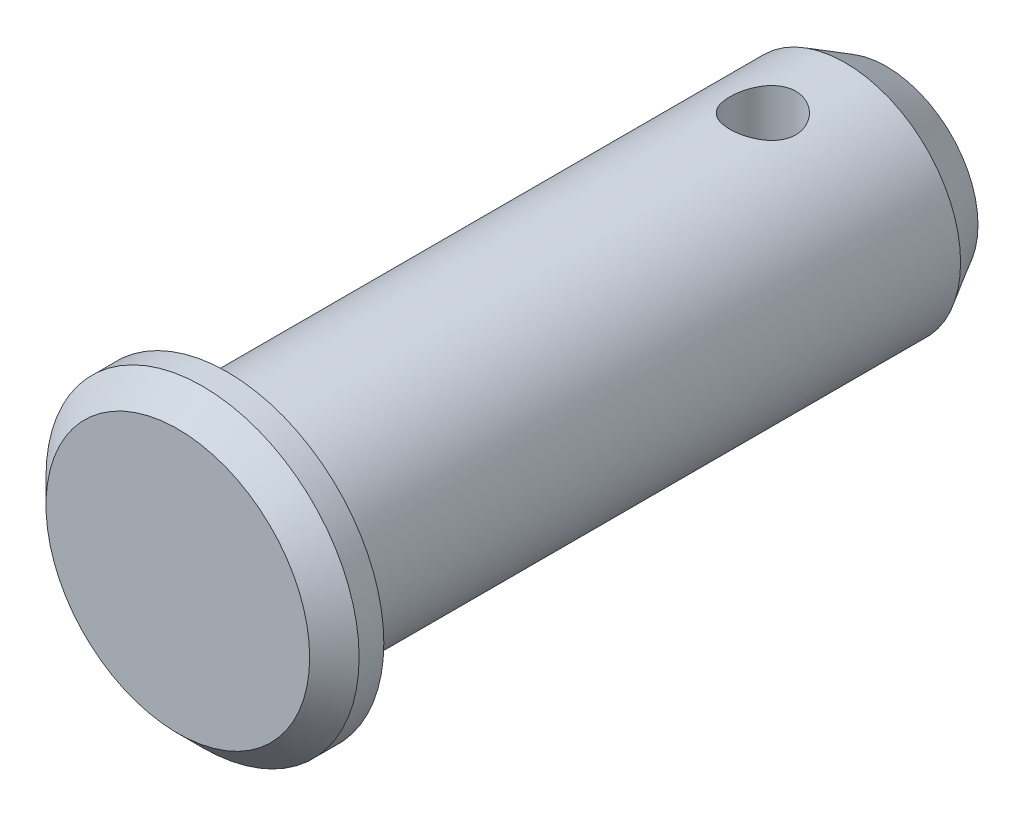
from build123d import *

# Parameters (mm, degrees)
WYTNIJ_WYCI_GNI_CIE1_DEPTH      = 26.352514668
WYTNIJ_WYCI_GNI_CIE1_DEPTH_BACK = 26.352514668
SZKIC2_R                        = 2


with BuildPart() as part:
    # Szkic1 → Obrót1 (revolve)
    with BuildSketch(Plane(origin=(0, 0, 0), x_dir=(1, 0, 0), z_dir=(0, 1, 0))):
        Polygon((0, -21.5), (8, -21.5), (9.5, -20), (9.5, -18.5), (7, -18.5), (7, 19), (5.556624327, 21.5), (0, 21.5), align=None)
    revolve(axis=Axis((0, 0, 21.5), (0, 0, -1)))

    # Szkic2 → Wytnij-wyciągnięcie1 (cut, two sides: drawn at the far end of the back side and taken through both)
    with BuildSketch(Plane(origin=(0, 0, 0), x_dir=(1, 0, 0), z_dir=(0, 1, 0)).offset(-WYTNIJ_WYCI_GNI_CIE1_DEPTH_BACK)):
        with Locations(Location((0, 14, 0), (0, 0, 270))):
            Circle(SZKIC2_R)
    extrude(amount=WYTNIJ_WYCI_GNI_CIE1_DEPTH + WYTNIJ_WYCI_GNI_CIE1_DEPTH_BACK, mode=Mode.SUBTRACT)


solid = part.part
